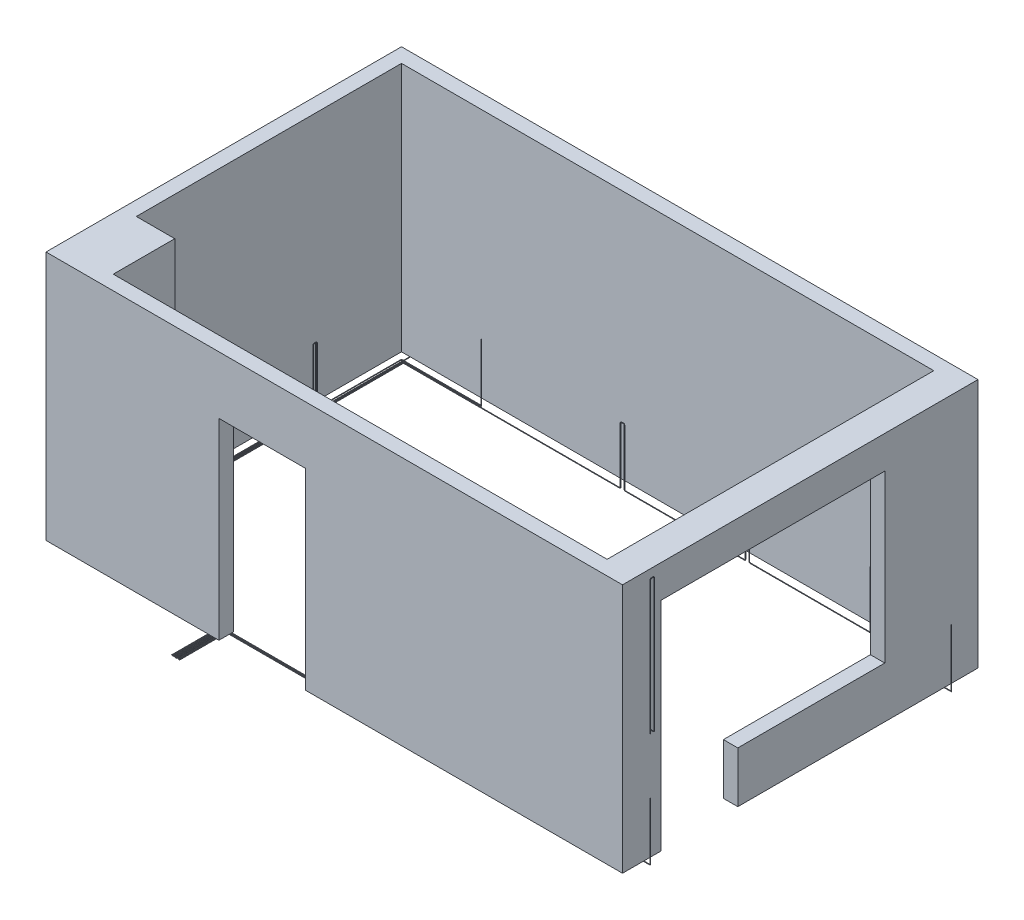
from build123d import *

# Parameters (mm, degrees)
LR_DIMENSIONS_W           = 90
LR_DIMENSIONS_H           = 15
LR_DIMENSIONS_W_2         = 15
LR_DIMENSIONS_H_2         = 80
LR_DIMENSIONS_W_3         = 40
LR_DIMENSIONS_H_3         = 64
LR_WALLS_EXTRUDE_DEPTH    = 260
LR_BALCONY_HOLE_CUT_DEPTH = 15
LR_SUPPORT_W              = 16
LR_SUPPORT_H              = 30
LR_SUPPORT_EXTRUDE_DEPTH  = 340
LR_DOOR_DIMENSIONS_W      = 90
LR_DOOR_DIMENSIONS_H      = 200
LR_DOOR_HOLE_CUT_DEPTH    = 15
EL_LINE_1_PROFILE_R       = 0.25
EL_LINE_2_PROFILE_R       = 0.25
EL_LINE_3_PROFILE_R       = 0.25
EL_LINE_4_PROFILE_R       = 0.25
NET_LINES_1_2_PROFILE_R   = 0.25
NET_LINES_3_4_PROFILE_R   = 0.25
NET_LINES_5_6_PROFILE_R   = 0.25
NET_LINES_7_8_PROFILE_R   = 0.25
LIGHTS_LINE_PROFILE_R     = 0.25


with BuildPart() as part:
    # LR Dimensions → LR Walls Extrude (new body)
    with BuildSketch(Plane(origin=(0, 0, 0), x_dir=(1, 0, 0), z_dir=(0, 1, 0))):
        with Locations((-75.772333152, -96.99336999)):
            Rectangle(LR_DIMENSIONS_W, LR_DIMENSIONS_H)
        Polygon((309.227666848, -89.49336999), (-30.772333152, -89.49336999), (-30.772333152, -104.49336999), (324.227666848, -104.49336999), (324.227666848, -49.49336999), (309.227666848, -49.49336999), align=None)
        with Locations((316.727666848, -9.49336999)):
            Rectangle(LR_DIMENSIONS_W_2, LR_DIMENSIONS_H_2)
        Polygon((-275.772333152, -104.49336999), (-120.772333152, -104.49336999), (-120.772333152, -89.49336999), (-260.772333152, -89.49336999), (-260.772333152, 250.50663001), (309.227666848, 250.50663001), (309.227666848, 30.50663001), (324.227666848, 30.50663001), (324.227666848, 265.50663001), (-275.772333152, 265.50663001), align=None)
        with Locations((-240.772333152, -57.49336999)):
            Rectangle(LR_DIMENSIONS_W_3, LR_DIMENSIONS_H_3)
    extrude(amount=LR_WALLS_EXTRUDE_DEPTH)

    # LR Balcony Hole Dimensions → LR Balcony Hole Cut (cut)
    with BuildSketch(Plane(origin=(324.227666848, 0, 0), x_dir=(0, 0, -1), z_dir=(1, 0, 0))):
        Polygon((-64.49336999, 226), (-64.49336999, 0), (15.50663001, 0), (15.50663001, 53), (168.50663001, 53), (168.50663001, 226), align=None)
    extrude(amount=-LR_BALCONY_HOLE_CUT_DEPTH, mode=Mode.SUBTRACT)

    # LR Support → LR Support Extrude (add)
    with BuildSketch(Plane(origin=(0, 0, 89.49336999), x_dir=(-1, 0, 0), z_dir=(0, 0, -1))):
        with Locations((-301.227666848, 245)):
            Rectangle(LR_SUPPORT_W, LR_SUPPORT_H)
    extrude(amount=LR_SUPPORT_EXTRUDE_DEPTH)

    # LR Door Dimensions → LR Door Hole Cut (cut)
    with BuildSketch(Plane.XY.offset(104.49336999)):
        with Locations((-50.772333152, 100)):
            Rectangle(LR_DOOR_DIMENSIONS_W, LR_DOOR_DIMENSIONS_H)
    extrude(amount=-LR_DOOR_HOLE_CUT_DEPTH, mode=Mode.SUBTRACT)


with BuildPart() as body_2:
    # El line 1: sweep along a curve in space
    with BuildLine() as el_line_1_path:
        Line((-175.772333152, -4, -248.50663001), (-175.772333152, 55, -248.50663001))
        ThreePointArc((-175.772333152, -4, -248.50663001), (-176.065226371, -4.707106781, -248.50663001), (-176.772333152, -5, -248.50663001))
        Line((-257.772333152, -5, -248.50663001), (-176.772333152, -5, -248.50663001))
        ThreePointArc((-257.772333152, -5, -248.50663001), (-258.479439933, -5, -248.213736792), (-258.772333152, -5, -247.50663001))
        Line((-258.772333152, -5, -161.50663001), (-258.772333152, -5, -247.50663001))
        ThreePointArc((-258.772333152, -5, -161.50663001), (-258.772333152, -4.707106781, -160.799523229), (-258.772333152, -4, -160.50663001))
        Line((-258.772333152, -4, -160.50663001), (-258.772333152, 54, -160.50663001))
        ThreePointArc((-258.772333152, 54, -160.50663001), (-258.772333152, 54.707106781, -160.213736792), (-258.772333152, 55, -159.50663001))
        Line((-258.772333152, 55, -157.50663001), (-258.772333152, 55, -159.50663001))
        ThreePointArc((-258.772333152, 54, -156.50663001), (-258.772333152, 54.707106781, -156.799523229), (-258.772333152, 55, -157.50663001))
        Line((-258.772333152, -4, -156.50663001), (-258.772333152, 54, -156.50663001))
        ThreePointArc((-258.772333152, -4, -156.50663001), (-258.772333152, -4.707106781, -156.213736792), (-258.772333152, -5, -155.50663001))
        Line((-258.772333152, -5, -69.50663001), (-258.772333152, -5, -155.50663001))
        ThreePointArc((-258.772333152, -5, -69.50663001), (-258.772333152, -4.707106781, -68.799523229), (-258.772333152, -4, -68.50663001))
        Line((-258.772333152, -4, -68.50663001), (-258.772333152, 54, -68.50663001))
        ThreePointArc((-258.772333152, 54, -68.50663001), (-258.772333152, 54.707106781, -68.213736792), (-258.772333152, 55, -67.50663001))
        Line((-258.772333152, 55, -67.50663001), (-258.772333152, 55, -65.50663001))
        ThreePointArc((-258.772333152, 54, -64.50663001), (-258.772333152, 54.707106781, -64.799523229), (-258.772333152, 55, -65.50663001))
        Line((-258.772333152, -4, -64.50663001), (-258.772333152, 54, -64.50663001))
        ThreePointArc((-258.772333152, -4, -64.50663001), (-258.772333152, -4.707106781, -64.213736792), (-258.772333152, -5, -63.50663001))
        Line((-258.772333152, -5, 22.49336999), (-258.772333152, -5, -63.50663001))
        ThreePointArc((-258.772333152, -5, 22.49336999), (-258.479439933, -5, 23.200476771), (-257.772333152, -5, 23.49336999))
        Line((-219.772333152, -5, 23.49336999), (-257.772333152, -5, 23.49336999))
        ThreePointArc((-219.772333152, -5, 23.49336999), (-219.065226371, -5, 23.786263208), (-218.772333152, -5, 24.49336999))
        Line((-218.772333152, -5, 86.49336999), (-218.772333152, -5, 24.49336999))
        ThreePointArc((-218.772333152, -5, 86.49336999), (-218.479439933, -5, 87.200476771), (-217.772333152, -5, 87.49336999))
        Line((-155.772333152, -5, 87.49336999), (-217.772333152, -5, 87.49336999))
        ThreePointArc((-155.772333152, -5, 87.49336999), (-155.065226371, -4.707106781, 87.49336999), (-154.772333152, -4, 87.49336999))
        Line((-154.772333152, -4, 87.49336999), (-154.772333152, 54, 87.49336999))
        ThreePointArc((-154.772333152, 54, 87.49336999), (-154.479439933, 54.707106781, 87.49336999), (-153.772333152, 55, 87.49336999))
        Line((-153.772333152, 55, 87.49336999), (-151.772333152, 55, 87.49336999))
        ThreePointArc((-150.772333152, 54, 87.49336999), (-151.065226371, 54.707106781, 87.49336999), (-151.772333152, 55, 87.49336999))
        Line((-150.772333152, -4, 87.49336999), (-150.772333152, 54, 87.49336999))
        ThreePointArc((-150.772333152, -4, 87.49336999), (-150.479439933, -4.707106781, 87.49336999), (-149.772333152, -5, 87.49336999))
        Line((-111.772333152, -5, 87.49336999), (-149.772333152, -5, 87.49336999))
        ThreePointArc((-110.772333152, -5, 88.49336999), (-111.065226371, -5, 87.786263208), (-111.772333152, -5, 87.49336999))
        Line((-110.772333152, -5, 88.49336999), (-110.772333152, -5, 137.49336999))
    # El line 1 profile (on start of the path) → El line 1 (sweep)
    with BuildSketch(Plane(origin=(-110.772333152, -5, 137.49336999), x_dir=(-1, 0, 0), z_dir=(0, 0, -1))):
        Circle(EL_LINE_1_PROFILE_R)
    sweep(path=el_line_1_path.line)

    # El line 2: sweep along a curve in space
    with BuildLine() as el_line_2_path:
        Line((-256.772333152, -5, -293.903501494), (-256.772333152, -5, 20.49336999))
        ThreePointArc((-255.772333152, -5, 21.49336999), (-256.479439933, -5, 21.200476771), (-256.772333152, -5, 20.49336999))
        Line((-255.772333152, -5, 21.49336999), (-217.772333152, -5, 21.49336999))
        ThreePointArc((-216.772333152, -5, 22.49336999), (-217.065226371, -5, 21.786263208), (-217.772333152, -5, 21.49336999))
        Line((-216.772333152, -5, 22.49336999), (-216.772333152, -5, 84.49336999))
        ThreePointArc((-215.772333152, -5, 85.49336999), (-216.479439933, -5, 85.200476771), (-216.772333152, -5, 84.49336999))
        Line((-215.772333152, -5, 85.49336999), (-109.772333152, -5, 85.49336999))
        ThreePointArc((-109.772333152, -5, 85.49336999), (-109.065226371, -5, 85.786263208), (-108.772333152, -5, 86.49336999))
        Line((-108.772333152, -5, 86.49336999), (-108.772333152, -5, 137.49336999))
    # El line 2 profile (on start of the path) → El line 2 (sweep)
    with BuildSketch(Plane(origin=(-256.772333152, -5, -293.903501494), x_dir=(1, 0, 0), z_dir=(0, 0, 1))):
        Circle(EL_LINE_2_PROFILE_R)
    sweep(path=el_line_2_path.line)


with BuildPart() as body_3:
    # El line 3: sweep along a curve in space
    with BuildLine() as el_line_3_path:
        Line((-106.772333152, -5, 84.49336999), (-106.772333152, -5, 137.49336999))
        ThreePointArc((-107.772333152, -5, 83.49336999), (-107.065226371, -5, 83.786263208), (-106.772333152, -5, 84.49336999))
        Line((-213.772333152, -5, 83.49336999), (-107.772333152, -5, 83.49336999))
        ThreePointArc((-213.772333152, -5, 83.49336999), (-214.479439933, -5, 83.200476771), (-214.772333152, -5, 82.49336999))
        Line((-214.772333152, -5, 20.49336999), (-214.772333152, -5, 82.49336999))
        ThreePointArc((-214.772333152, -5, 20.49336999), (-215.065226371, -5, 19.786263208), (-215.772333152, -5, 19.49336999))
        Line((-253.772333152, -5, 19.49336999), (-215.772333152, -5, 19.49336999))
        ThreePointArc((-253.772333152, -5, 19.49336999), (-254.479439933, -5, 19.200476771), (-254.772333152, -5, 18.49336999))
        Line((-254.772333152, -5, -245.50663001), (-254.772333152, -5, 18.49336999))
        ThreePointArc((-253.772333152, -5, -246.50663001), (-254.479439933, -5, -246.213736792), (-254.772333152, -5, -245.50663001))
        Line((-29.772333152, -5, -246.50663001), (-253.772333152, -5, -246.50663001))
        ThreePointArc((-28.772333152, -4, -246.50663001), (-29.065226371, -4.707106781, -246.50663001), (-29.772333152, -5, -246.50663001))
        Line((-28.772333152, -4, -246.50663001), (-28.772333152, 54, -246.50663001))
        ThreePointArc((-28.772333152, 54, -246.50663001), (-28.479439933, 54.707106781, -246.50663001), (-27.772333152, 55, -246.50663001))
        Line((-27.772333152, 55, -246.50663001), (-25.772333152, 55, -246.50663001))
        ThreePointArc((-24.772333152, 54, -246.50663001), (-25.065226371, 54.707106781, -246.50663001), (-25.772333152, 55, -246.50663001))
        Line((-24.772333152, -4, -246.50663001), (-24.772333152, 54, -246.50663001))
        ThreePointArc((-23.772333152, -5, -246.50663001), (-24.479439933, -4.707106781, -246.50663001), (-24.772333152, -4, -246.50663001))
        Line((100.227666848, -5, -246.50663001), (-23.772333152, -5, -246.50663001))
        ThreePointArc((101.227666848, -4, -246.50663001), (100.934773629, -4.707106781, -246.50663001), (100.227666848, -5, -246.50663001))
        Line((101.227666848, -4, -246.50663001), (101.227666848, 54, -246.50663001))
        ThreePointArc((101.227666848, 54, -246.50663001), (101.520560067, 54.707106781, -246.50663001), (102.227666848, 55, -246.50663001))
        Line((104.227666848, 55, -246.50663001), (102.227666848, 55, -246.50663001))
        ThreePointArc((104.227666848, 55, -246.50663001), (104.934773629, 54.707106781, -246.50663001), (105.227666848, 54, -246.50663001))
        Line((105.227666848, -4, -246.50663001), (105.227666848, 54, -246.50663001))
        ThreePointArc((106.227666848, -5, -246.50663001), (105.520560067, -4.707106781, -246.50663001), (105.227666848, -4, -246.50663001))
        Line((230.227666848, -5, -246.50663001), (106.227666848, -5, -246.50663001))
        ThreePointArc((230.227666848, -5, -246.50663001), (230.934773629, -4.707106781, -246.50663001), (231.227666848, -4, -246.50663001))
        Line((231.227666848, -4, -246.50663001), (231.227666848, 54, -246.50663001))
        ThreePointArc((231.227666848, 54, -246.50663001), (231.520560067, 54.707106781, -246.50663001), (232.227666848, 55, -246.50663001))
        Line((234.227666848, 55, -246.50663001), (232.227666848, 55, -246.50663001))
        ThreePointArc((234.227666848, 55, -246.50663001), (234.934773629, 54.707106781, -246.50663001), (235.227666848, 54, -246.50663001))
        Line((235.227666848, -4, -246.50663001), (235.227666848, 54, -246.50663001))
        ThreePointArc((235.227666848, -4, -246.50663001), (235.520560067, -4.707106781, -246.50663001), (236.227666848, -5, -246.50663001))
        Line((236.227666848, -5, -246.50663001), (306.227666848, -5, -246.50663001))
        ThreePointArc((307.227666848, -5, -245.50663001), (306.934773629, -5, -246.213736792), (306.227666848, -5, -246.50663001))
        Line((307.227666848, -5, -245.50663001), (307.227666848, -5, -236.50663001))
        ThreePointArc((308.227666848, -5, -235.50663001), (307.520560067, -5, -235.799523229), (307.227666848, -5, -236.50663001))
        Line((308.227666848, -5, -235.50663001), (326.227666848, -5, -235.50663001))
        Line((326.227666848, -5, -235.50663001), (326.227666848, 55, -235.50663001))
    # El line 3 profile (on start of the path) → El line 3 (sweep)
    with BuildSketch(Plane(origin=(326.227666848, 55, -235.50663001), x_dir=(-1, 0, 0), z_dir=(0, -1, 0))):
        Circle(EL_LINE_3_PROFILE_R)
    sweep(path=el_line_3_path.line, transition=Transition.RIGHT)


with BuildPart() as body_4:
    # El line 4: sweep along a curve in space
    with BuildLine() as el_line_4_path:
        Line((-104.772333152, -5, 137.49336999), (-104.772333152, -5, 88.49336999))
        ThreePointArc((-103.772333152, -5, 87.49336999), (-104.479439933, -5, 87.786263208), (-104.772333152, -5, 88.49336999))
        Line((-103.772333152, -5, 87.49336999), (123.227666848, -5, 87.49336999))
        ThreePointArc((124.227666848, -4, 87.49336999), (123.934773629, -4.707106781, 87.49336999), (123.227666848, -5, 87.49336999))
        Line((124.227666848, -4, 87.49336999), (124.227666848, 54, 87.49336999))
        ThreePointArc((125.227666848, 55, 87.49336999), (124.520560067, 54.707106781, 87.49336999), (124.227666848, 54, 87.49336999))
        Line((125.227666848, 55, 87.49336999), (127.227666848, 55, 87.49336999))
        ThreePointArc((128.227666848, 54, 87.49336999), (127.934773629, 54.707106781, 87.49336999), (127.227666848, 55, 87.49336999))
        Line((128.227666848, -4, 87.49336999), (128.227666848, 54, 87.49336999))
        ThreePointArc((129.227666848, -5, 87.49336999), (128.520560067, -4.707106781, 87.49336999), (128.227666848, -4, 87.49336999))
        Line((129.227666848, -5, 87.49336999), (306.227666848, -5, 87.49336999))
        ThreePointArc((306.227666848, -5, 87.49336999), (306.934773629, -5, 87.200476771), (307.227666848, -5, 86.49336999))
        Line((307.227666848, -5, 86.49336999), (307.227666848, -5, 78.49336999))
        ThreePointArc((308.227666848, -5, 77.49336999), (307.520560067, -5, 77.786263208), (307.227666848, -5, 78.49336999))
        Line((308.227666848, -5, 77.49336999), (325.227666848, -5, 77.49336999))
        ThreePointArc((326.227666848, -4, 77.49336999), (325.934773629, -4.707106781, 77.49336999), (325.227666848, -5, 77.49336999))
        Line((326.227666848, -4, 77.49336999), (326.227666848, 55, 77.49336999))
    # El line 4 profile (on start of the path) → El line 4 (sweep)
    with BuildSketch(Plane(origin=(-104.772333152, -5, 137.49336999), x_dir=(-1, 0, 0), z_dir=(0, 0, -1))):
        Circle(EL_LINE_4_PROFILE_R)
    sweep(path=el_line_4_path.line)


with BuildPart() as body_5:
    # Net lines 1 & 2: sweep along a curve in space
    with BuildLine() as net_lines_1_2_path:
        Line((-111.7518662, -4.798716599, 137.472903038), (-111.7518662, -4.798716599, 89.472903038))
        ThreePointArc((-111.7518662, -4.798716599, 89.472903038), (-112.044759419, -4.798716599, 88.765796257), (-112.7518662, -4.798716599, 88.472903038))
        Line((-112.7518662, -4.798716599, 88.472903038), (-218.7518662, -4.798716599, 88.472903038))
        ThreePointArc((-218.7518662, -4.798716599, 88.472903038), (-219.458972981, -4.798716599, 88.180009819), (-219.7518662, -4.798716599, 87.472903038))
        Line((-219.7518662, -4.798716599, 87.472903038), (-219.7518662, -4.798716599, 25.472903038))
        ThreePointArc((-219.7518662, -4.798716599, 25.472903038), (-220.044759419, -4.798716599, 24.765796257), (-220.7518662, -4.798716599, 24.472903038))
        Line((-220.7518662, -4.798716599, 24.472903038), (-258.7518662, -4.798716599, 24.472903038))
        ThreePointArc((-258.7518662, -4.798716599, 24.472903038), (-259.458972981, -4.798716599, 24.180009819), (-259.7518662, -4.798716599, 23.472903038))
        Line((-259.7518662, -4.798716599, 23.472903038), (-259.7518662, -4.798716599, -65.527096962))
        ThreePointArc((-259.7518662, -3.798716599, -66.527096962), (-259.7518662, -4.50582338, -66.234203743), (-259.7518662, -4.798716599, -65.527096962))
        Line((-259.7518662, -3.798716599, -66.527096962), (-259.7518662, 55.201283401, -66.527096962))
    # Net lines 1 & 2 profile (on start of the path) → Net lines 1 & 2 (sweep)
    with BuildSketch(Plane(origin=(-111.7518662, -4.798716599, 137.472903038), x_dir=(0, -1, 0), z_dir=(0, 0, -1))):
        Circle(NET_LINES_1_2_PROFILE_R)
    sweep(path=net_lines_1_2_path.line)


with BuildPart() as body_6:
    # Net lines 3 & 4: sweep along a curve in space
    with BuildLine() as net_lines_3_4_path:
        Line((-109.772333152, -5, 137.49336999), (-109.772333152, -5, 87.49336999))
        ThreePointArc((-109.772333152, -5, 87.49336999), (-110.065226371, -5, 86.786263208), (-110.772333152, -5, 86.49336999))
        Line((-110.772333152, -5, 86.49336999), (-216.772333152, -5, 86.49336999))
        ThreePointArc((-216.772333152, -5, 86.49336999), (-217.479439933, -5, 86.200476771), (-217.772333152, -5, 85.49336999))
        Line((-217.772333152, -5, 85.49336999), (-217.772333152, -5, 23.49336999))
        ThreePointArc((-217.772333152, -5, 23.49336999), (-218.065226371, -5, 22.786263208), (-218.772333152, -5, 22.49336999))
        Line((-218.772333152, -5, 22.49336999), (-256.772333152, -5, 22.49336999))
        ThreePointArc((-256.772333152, -5, 22.49336999), (-257.479439933, -5, 22.200476771), (-257.772333152, -5, 21.49336999))
        Line((-257.772333152, -5, 21.49336999), (-257.772333152, -5, -157.50663001))
        ThreePointArc((-257.772333152, -5, -157.50663001), (-257.772333152, -4.707106781, -158.213736792), (-257.772333152, -4, -158.50663001))
        Line((-257.772333152, -4, -158.50663001), (-257.772333152, 55, -158.50663001))
    # Net lines 3 & 4 profile (on start of the path) → Net lines 3 & 4 (sweep)
    with BuildSketch(Plane(origin=(-109.772333152, -5, 137.49336999), x_dir=(-1, 0, 0), z_dir=(0, 0, -1))):
        Circle(NET_LINES_3_4_PROFILE_R)
    sweep(path=net_lines_3_4_path.line)


with BuildPart() as body_7:
    # Net lines 5 & 6: sweep along a curve in space
    with BuildLine() as net_lines_5_6_path:
        Line((-107.772333152, -5, 137.49336999), (-107.772333152, -5, 85.49336999))
        ThreePointArc((-107.772333152, -5, 85.49336999), (-108.065226371, -5, 84.786263208), (-108.772333152, -5, 84.49336999))
        Line((-108.772333152, -5, 84.49336999), (-214.772333152, -5, 84.49336999))
        ThreePointArc((-214.772333152, -5, 84.49336999), (-215.479439933, -5, 84.200476771), (-215.772333152, -5, 83.49336999))
        Line((-215.772333152, -5, 83.49336999), (-215.772333152, -5, 21.49336999))
        ThreePointArc((-215.772333152, -5, 21.49336999), (-216.065226371, -5, 20.786263208), (-216.772333152, -5, 20.49336999))
        Line((-216.772333152, -5, 20.49336999), (-254.772333152, -5, 20.49336999))
        ThreePointArc((-254.772333152, -5, 20.49336999), (-255.479439933, -5, 20.200476771), (-255.772333152, -5, 19.49336999))
        Line((-255.772333152, -5, 19.49336999), (-255.772333152, -5, -246.50663001))
        ThreePointArc((-255.772333152, -5, -246.50663001), (-255.479439933, -5, -247.213736792), (-254.772333152, -5, -247.50663001))
        Line((-254.772333152, -5, -247.50663001), (-175.772333152, -5, -247.50663001))
        ThreePointArc((-175.772333152, -5, -247.50663001), (-175.065226371, -4.707106781, -247.50663001), (-174.772333152, -4, -247.50663001))
        Line((-174.772333152, -4, -247.50663001), (-174.772333152, 55, -247.50663001))
    # Net lines 5 & 6 profile (on start of the path) → Net lines 5 & 6 (sweep)
    with BuildSketch(Plane(origin=(-107.772333152, -5, 137.49336999), x_dir=(-1, 0, 0), z_dir=(0, 0, -1))):
        Circle(NET_LINES_5_6_PROFILE_R)
    sweep(path=net_lines_5_6_path.line)


with BuildPart() as body_8:
    # Net lines 7 & 8: sweep along a curve in space
    with BuildLine() as net_lines_7_8_path:
        Line((-105.749955619, -4.789632912, 137.515747523), (-105.749955619, -4.789632912, 87.515747523))
        ThreePointArc((-105.749955619, -4.789632912, 87.515747523), (-105.4570624, -4.789632912, 86.808640741), (-104.749955619, -4.789632912, 86.515747523))
        Line((-104.749955619, -4.789632912, 86.515747523), (125.629045153, -4.789632912, 86.515747523))
        ThreePointArc((125.629045153, -4.789632912, 86.515747523), (126.336151934, -4.496739693, 86.515747523), (126.629045153, -3.789632912, 86.515747523))
        Line((126.629045153, -3.789632912, 86.515747523), (126.629045153, 55.210367088, 86.515747523))
    # Net lines 7 & 8 profile (on start of the path) → Net lines 7 & 8 (sweep)
    with BuildSketch(Plane(origin=(-105.749955619, -4.789632912, 137.515747523), x_dir=(-1, 0, 0), z_dir=(0, 0, -1))):
        Circle(NET_LINES_7_8_PROFILE_R)
    sweep(path=net_lines_7_8_path.line)


with BuildPart() as body_9:
    # Lights line: sweep along a curve in space
    with BuildLine() as lights_line_path:
        Line((-103.772333152, -5, 137.740945935), (-103.772333152, -5, 89.49336999))
        ThreePointArc((-102.772333152, -5, 88.49336999), (-103.479439933, -5, 88.786263208), (-103.772333152, -5, 89.49336999))
        Line((-102.772333152, -5, 88.49336999), (20.227666848, -5, 88.49336999))
        ThreePointArc((21.227666848, -4, 88.49336999), (20.934773629, -4.707106781, 88.49336999), (20.227666848, -5, 88.49336999))
        Line((21.227666848, -4, 88.49336999), (21.227666848, 254, 88.49336999))
        ThreePointArc((21.227666848, 254, 88.49336999), (21.520560067, 254.707106781, 88.49336999), (22.227666848, 255, 88.49336999))
        Line((24.227666848, 255, 88.49336999), (22.227666848, 255, 88.49336999))
        ThreePointArc((25.227666848, 254, 88.49336999), (24.934773629, 254.707106781, 88.49336999), (24.227666848, 255, 88.49336999))
        Line((25.227666848, -4, 88.49336999), (25.227666848, 254, 88.49336999))
        ThreePointArc((26.227666848, -5, 88.49336999), (25.520560067, -4.707106781, 88.49336999), (25.227666848, -4, 88.49336999))
        Line((26.227666848, -5, 88.49336999), (307.227666848, -5, 88.49336999))
        ThreePointArc((307.227666848, -5, 88.49336999), (307.934773629, -5, 88.200476771), (308.227666848, -5, 87.49336999))
        Line((308.227666848, -5, 87.49336999), (308.227666848, -5, 76.49336999))
        ThreePointArc((308.227666848, -5, 76.49336999), (308.227666848, -4.707106781, 75.786263208), (308.227666848, -4, 75.49336999))
        Line((308.227666848, -4, 75.49336999), (308.227666848, 114, 75.49336999))
        ThreePointArc((309.227666848, 115, 75.49336999), (308.520560067, 114.707106781, 75.49336999), (308.227666848, 114, 75.49336999))
        Line((309.227666848, 115, 75.49336999), (327.227666848, 115, 75.49336999))
        ThreePointArc((327.227666848, 115, 75.49336999), (327.934773629, 115.292893219, 75.49336999), (328.227666848, 116, 75.49336999))
        Line((328.227666848, 116, 75.49336999), (328.227666848, 254, 75.49336999))
        ThreePointArc((328.227666848, 254, 75.49336999), (328.227666848, 254.707106781, 75.786263208), (328.227666848, 255, 76.49336999))
        Line((328.227666848, 255, 76.49336999), (328.227666848, 255, 78.49336999))
        ThreePointArc((328.227666848, 254, 79.49336999), (328.227666848, 254.707106781, 79.200476771), (328.227666848, 255, 78.49336999))
        Line((328.227666848, 254, 79.49336999), (328.227666848, 115, 79.49336999))
    # Lights line profile (on start of the path) → Lights line (sweep)
    with BuildSketch(Plane(origin=(-103.772333152, -5, 137.740945935), x_dir=(-1, 0, 0), z_dir=(0, 0, -1))):
        Circle(LIGHTS_LINE_PROFILE_R)
    sweep(path=lights_line_path.line)


solid = Compound([part.part, body_2.part, body_3.part, body_4.part, body_5.part, body_6.part, body_7.part, body_8.part, body_9.part])
